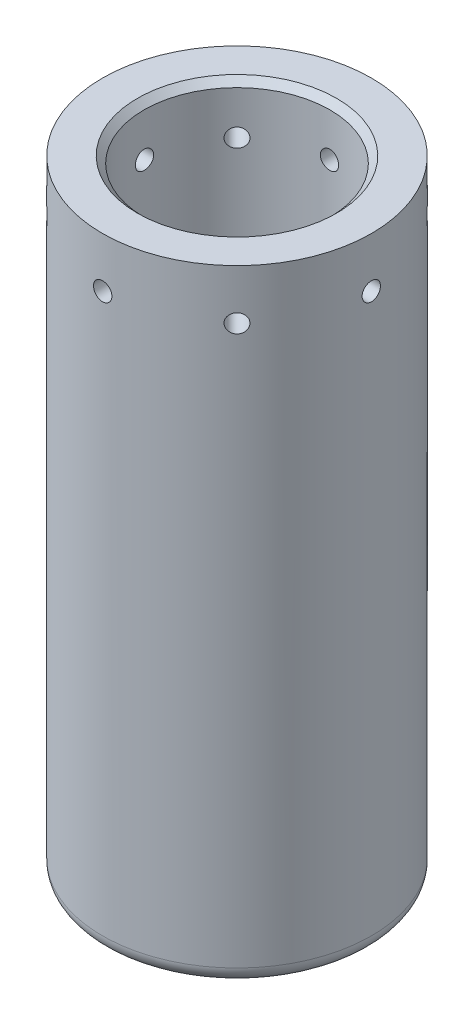
from build123d import *

# Parameters (mm, degrees)
SKETCH1_R           = 16.15
SKETCH1_R_2         = 11.15
BOSS_EXTRUDE1_DEPTH = 70
BOSS_EXTRUDE2_START = 5
SKETCH2_R           = 16.15
BOSS_EXTRUDE2_DEPTH = 5
CHAMFER1_SIZE       = 5
FILLET1_R           = 2
CHAMFER2_SIZE       = 0.8
SKETCH3_R           = 1.1
CUT_EXTRUDE1_DEPTH  = 10
CIRPATTERN1_COUNT   = 8


with BuildPart() as part:
    # Sketch1 → Boss-Extrude1 (new body)
    with BuildSketch(Plane(origin=(0, 0, 0), x_dir=(1, 0, 0), z_dir=(0, 1, 0))):
        with Locations(Location((0, 0, 0), (0, 0, 270))):
            Circle(SKETCH1_R)
        with Locations(Location((0, 0, 0), (0, 0, 270))):
            Circle(SKETCH1_R_2, mode=Mode.SUBTRACT)
    extrude(amount=BOSS_EXTRUDE1_DEPTH)

    # Sketch2 → Boss-Extrude2 (add)
    with BuildSketch(Plane.XZ.offset(BOSS_EXTRUDE2_START)):
        with Locations(Location((0, 0, 0), (0, 0, 270))):
            Circle(SKETCH2_R)
    extrude(amount=-BOSS_EXTRUDE2_DEPTH)

    # Chamfer1
    chamfer1_edges = [part.edges().sort_by_distance(p)[0] for p in [
        (0, 0, -11.15),
    ]]
    chamfer(chamfer1_edges, length=CHAMFER1_SIZE)

    # Fillet1
    fillet1_edges = [part.edges().sort_by_distance(p)[0] for p in [
        (0, -5, 16.15),
    ]]
    fillet(fillet1_edges, radius=FILLET1_R)

    # Chamfer2
    chamfer2_edges = [part.edges().sort_by_distance(p)[0] for p in [
        (0, 70, -11.15),
    ]]
    chamfer(chamfer2_edges, length=CHAMFER2_SIZE)

    # Sketch3 → Cut-Extrude1 (cut)
    with BuildSketch(Plane(origin=(16.15, 0, 0), x_dir=(0, 0, -1), z_dir=(1, 0, 0))):
        with Locations((0, 64)):
            Circle(SKETCH3_R)
    cut_extrude1 = extrude(amount=-CUT_EXTRUDE1_DEPTH, mode=Mode.SUBTRACT)

    # CirPattern1: Cut-Extrude1 ×8 about axis
    cirpattern1_axis = Axis((0, 69.2, 0), (0, -1, 0))
    for i in range(1, CIRPATTERN1_COUNT):
        add(cut_extrude1.rotate(cirpattern1_axis, i * 360 / CIRPATTERN1_COUNT), mode=Mode.SUBTRACT)


solid = part.part
